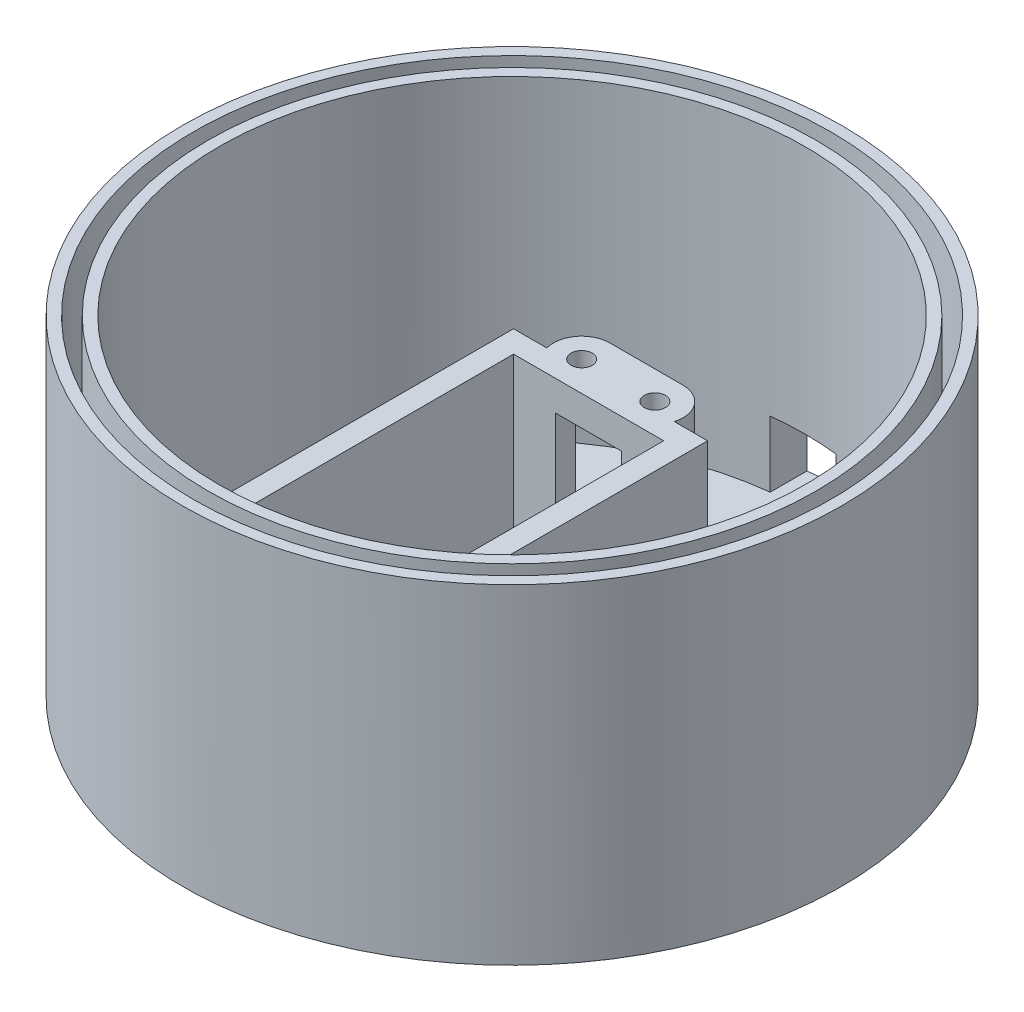
from build123d import *

# Parameters (mm, degrees)
CROQUIS2_R              = 1.45
SALIENTE_EXTRUIR1_DEPTH = 2
CROQUIS3_W              = 26.5
CROQUIS3_H              = 46.9
CROQUIS3_W_2            = 20.5
CROQUIS3_H_2            = 40.9
SALIENTE_EXTRUIR2_DEPTH = 28.1
SALIENTE_EXTRUIR3_DEPTH = 3.5
CROQUIS5_R              = 1.45
CORTAR_EXTRUIR1_DEPTH   = 48.534565862
CROQUIS6_W              = 9
CROQUIS6_H              = 24
CORTAR_EXTRUIR2_DEPTH   = 3.5
CROQUIS7_R              = 45
SALIENTE_EXTRUIR4_DEPTH = 2
CROQUIS8_R              = 45
CROQUIS8_R_2            = 40
SALIENTE_EXTRUIR5_DEPTH = 43
CROQUIS9_R              = 43.5
CROQUIS9_R_2            = 41.5
CORTAR_EXTRUIR3_DEPTH   = 30
CROQUIS10_W             = 9
CROQUIS10_H             = 9
CORTAR_EXTRUIR4_DEPTH   = 87.409541035
CROQUIS11_R             = 1.45
CORTAR_EXTRUIR5_DEPTH   = 84.05905068


with BuildPart() as part:
    # Croquis2 → Saliente-Extruir1 (new body)
    with BuildSketch(Plane(origin=(0, 0, 0), x_dir=(1, 0, 0), z_dir=(0, 1, 0))):
        with BuildLine():
            Line((-23.45, 5), (-23.45, -5))
            ThreePointArc((-23.45, -5), (-22.439518395, -7.439518395), (-20, -8.45))
            Line((-20, -8.45), (-13.25, -8.45))
            Line((-13.25, -8.45), (-13.25, -23.45))
            Line((-13.25, -23.45), (13.25, -23.45))
            Line((13.25, -23.45), (13.25, -8.45))
            Line((13.25, -8.45), (20, -8.45))
            ThreePointArc((20, -8.45), (22.439518395, -7.439518395), (23.45, -5))
            Line((23.45, -5), (23.45, 5))
            ThreePointArc((23.45, 5), (22.439518395, 7.439518395), (20, 8.45))
            Line((20, 8.45), (13.25, 8.45))
            Line((13.25, 8.45), (13.25, 23.45))
            Line((13.25, 23.45), (-13.25, 23.45))
            Line((-13.25, 23.45), (-13.25, 8.45))
            Line((-13.25, 8.45), (-20, 8.45))
            ThreePointArc((-20, 8.45), (-22.439518395, 7.439518395), (-23.45, 5))
        make_face()
        with Locations(Location((-20, 5, 0), (0, 0, 270))):
            Circle(CROQUIS2_R, mode=Mode.SUBTRACT)
        with Locations(Location((-20, -5, 0), (0, 0, 90))):
            Circle(CROQUIS2_R, mode=Mode.SUBTRACT)
        with Locations(Location((20, -5, 0), (0, 0, 270))):
            Circle(CROQUIS2_R, mode=Mode.SUBTRACT)
        with Locations(Location((20, 5, 0), (0, 0, 90))):
            Circle(CROQUIS2_R, mode=Mode.SUBTRACT)
        with Locations(Location((-20, 0, 0), (0, 0, 270))):
            Circle(CROQUIS2_R, mode=Mode.SUBTRACT)
        with Locations(Location((20, 0, 0), (0, 0, 90))):
            Circle(CROQUIS2_R, mode=Mode.SUBTRACT)
    extrude(amount=SALIENTE_EXTRUIR1_DEPTH)

    # Croquis3 → Saliente-Extruir2 (add)
    with BuildSketch(Plane(origin=(0, 2, 0), x_dir=(1, 0, 0), z_dir=(0, 1, 0))):
        Rectangle(CROQUIS3_W, CROQUIS3_H)
        Rectangle(CROQUIS3_W_2, CROQUIS3_H_2, mode=Mode.SUBTRACT)
    extrude(amount=SALIENTE_EXTRUIR2_DEPTH)

    # Croquis4 → Saliente-Extruir3 (add)
    with BuildSketch(Plane(origin=(0, 30.1, 0), x_dir=(1, 0, 0), z_dir=(0, 1, 0))):
        with BuildLine():
            Line((-5, 28.348235425), (5, 28.348235425))
            ThreePointArc((5, 28.348235425), (8.069980707, 26.820373751), (8.702217698, 23.45))
            Line((8.702217698, 23.45), (-8.702217698, 23.45))
            ThreePointArc((-8.702217698, 23.45), (-8.069980707, 26.820373751), (-5, 28.348235425))
        make_face()
        with BuildLine():
            Line((-8.702217698, -23.45), (8.702217698, -23.45))
            ThreePointArc((8.702217698, -23.45), (8.069980707, -26.820373751), (5, -28.348235425))
            Line((5, -28.348235425), (-5, -28.348235425))
            ThreePointArc((-5, -28.348235425), (-8.069980707, -26.820373751), (-8.702217698, -23.45))
        make_face()
    extrude(amount=-SALIENTE_EXTRUIR3_DEPTH)

    # Croquis5 → Cortar-Extruir1 (cut, through all)
    with BuildSketch(Plane(origin=(0, 30.1, 0), x_dir=(1, 0, 0), z_dir=(0, 1, 0))):
        with Locations(Location((-5, 24.5, 0), (0, 0, 270))):
            Circle(CROQUIS5_R)
        with Locations(Location((5, 24.5, 0), (0, 0, 313.602818973))):
            Circle(CROQUIS5_R)
        with Locations(Location((5, -24.5, 0), (0, 0, 270))):
            Circle(CROQUIS5_R)
        with Locations(Location((-5, -24.5, 0), (0, 0, 133.602818973))):
            Circle(CROQUIS5_R)
    extrude(amount=-CORTAR_EXTRUIR1_DEPTH, mode=Mode.SUBTRACT)

    # Croquis6 → Cortar-Extruir2 (cut)
    with BuildSketch(Plane(origin=(0, 0, -23.45), x_dir=(-1, 0, 0), z_dir=(0, 0, -1))):
        with Locations((0, 14)):
            Rectangle(CROQUIS6_W, CROQUIS6_H)
    extrude(amount=-CORTAR_EXTRUIR2_DEPTH, mode=Mode.SUBTRACT)

    # Croquis7 → Saliente-Extruir4 (add)
    with BuildSketch(Plane.XZ):
        with Locations(Location((0, -9.998235425, 0), (0, 0, 270))):
            Circle(CROQUIS7_R)
    extrude(amount=-SALIENTE_EXTRUIR4_DEPTH)

    # Croquis8 → Saliente-Extruir5 (add)
    with BuildSketch(Plane(origin=(0, 2, 0), x_dir=(1, 0, 0), z_dir=(0, 1, 0))):
        with Locations(Location((0, 9.998235425, 0), (0, 0, 90))):
            Circle(CROQUIS8_R)
        with Locations(Location((0, 9.998235425, 0), (0, 0, 270))):
            Circle(CROQUIS8_R_2, mode=Mode.SUBTRACT)
    extrude(amount=SALIENTE_EXTRUIR5_DEPTH)

    # Croquis9 → Cortar-Extruir3 (cut)
    with BuildSketch(Plane(origin=(0, 45, 0), x_dir=(1, 0, 0), z_dir=(0, 1, 0))):
        with Locations(Location((0, 9.998235425, 0), (0, 0, 270))):
            Circle(CROQUIS9_R)
        with Locations(Location((0, 9.998235425, 0), (0, 0, 270))):
            Circle(CROQUIS9_R_2, mode=Mode.SUBTRACT)
    extrude(amount=-CORTAR_EXTRUIR3_DEPTH, mode=Mode.SUBTRACT)

    # Croquis10 → Cortar-Extruir4 (cut, through all)
    with BuildSketch(Plane(origin=(0, 0, -23.45), x_dir=(-1, 0, 0), z_dir=(0, 0, -1))):
        with Locations((0, 6.5)):
            Rectangle(CROQUIS10_W, CROQUIS10_H)
    extrude(amount=CORTAR_EXTRUIR4_DEPTH, mode=Mode.SUBTRACT)

    # Croquis11 → Cortar-Extruir5 (cut, through all)
    with BuildSketch(Plane(origin=(0, 2, 0), x_dir=(1, 0, 0), z_dir=(0, 1, 0))):
        with Locations(Location((-20, 9.998235425, 0), (0, 0, 270))):
            Circle(CROQUIS11_R)
        with Locations(Location((20, 9.998235425, 0), (0, 0, 90))):
            Circle(CROQUIS11_R)
    extrude(amount=-CORTAR_EXTRUIR5_DEPTH, mode=Mode.SUBTRACT)


solid = part.part
